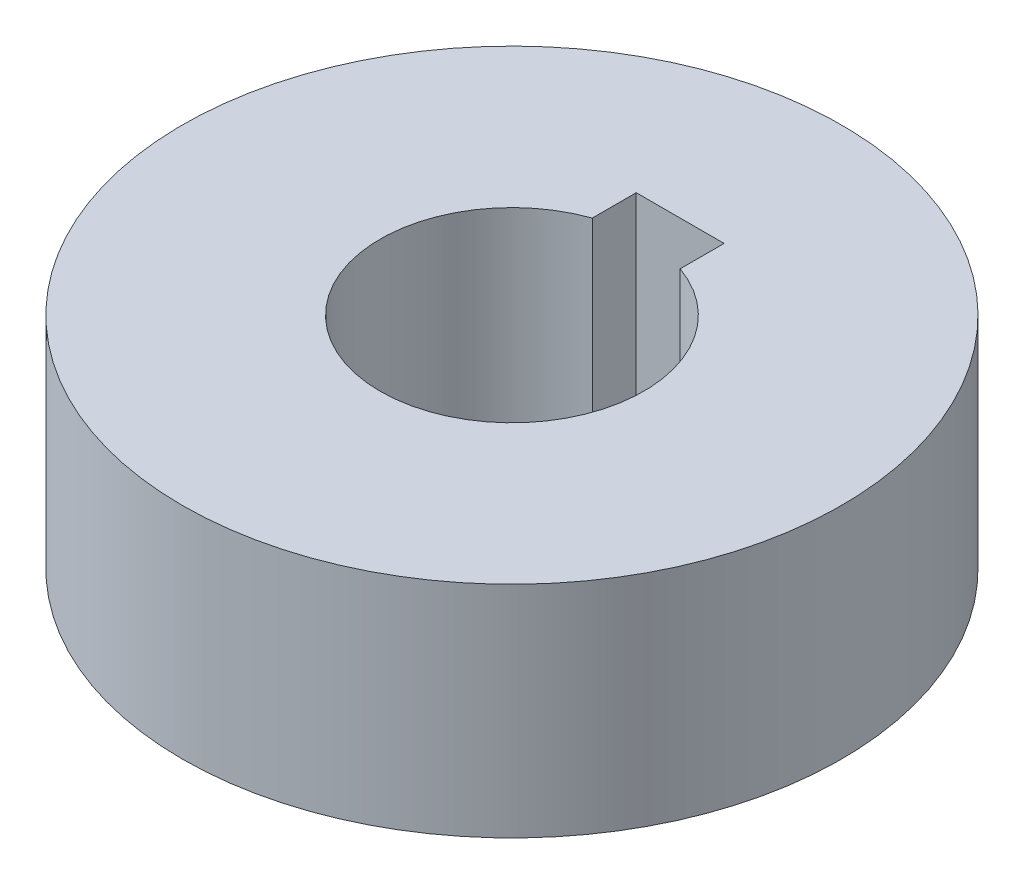
from build123d import *

# Parameters (mm, degrees)
SKETCH1_R           = 15
SKETCH1_R_2         = 6
BOSS_EXTRUDE1_DEPTH = 10
CUT_EXTRUDE1_DEPTH  = 24.452078799


with BuildPart() as part:
    # Sketch1 → Boss-Extrude1 (new body)
    with BuildSketch(Plane(origin=(0, 0, 0), x_dir=(1, 0, 0), z_dir=(0, 1, 0))):
        with Locations(Location((0, 0, 0), (0, 0, 270))):
            Circle(SKETCH1_R)
        with Locations(Location((0, 0, 0), (0, 0, 270))):
            Circle(SKETCH1_R_2, mode=Mode.SUBTRACT)
    extrude(amount=BOSS_EXTRUDE1_DEPTH)

    # Sketch2 → Cut-Extrude1 (cut, through all)
    with BuildSketch(Plane(origin=(0, 10, 0), x_dir=(1, 0, 0), z_dir=(0, 1, 0))):
        with BuildLine():
            Line((2, 5.656854249), (2, 7.656854249))
            Line((2, 7.656854249), (-2, 7.656854249))
            Line((-2, 7.656854249), (-2, 5.656854249))
            ThreePointArc((-2, 5.656854249), (0, 6), (2, 5.656854249))
        make_face()
    extrude(amount=-CUT_EXTRUDE1_DEPTH, mode=Mode.SUBTRACT)


solid = part.part
